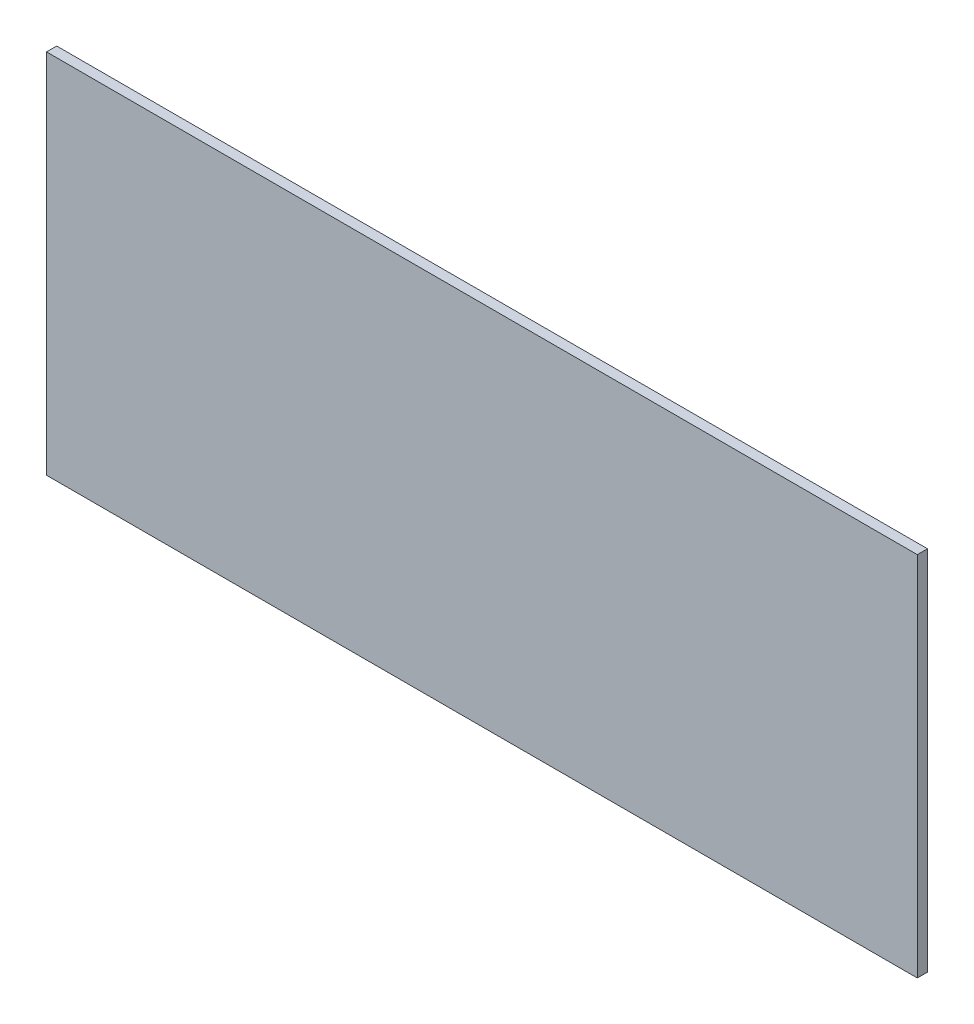
from build123d import *

# Parameters (mm, degrees)
SKETCH1_W           = 171
SKETCH1_H           = 72
BOSS_EXTRUDE1_DEPTH = 2


with BuildPart() as part:
    # Sketch1 → Boss-Extrude1 (new body)
    with BuildSketch(Plane.XY):
        with Locations((1.5, 0)):
            Rectangle(SKETCH1_W, SKETCH1_H)
    extrude(amount=BOSS_EXTRUDE1_DEPTH)


solid = part.part
